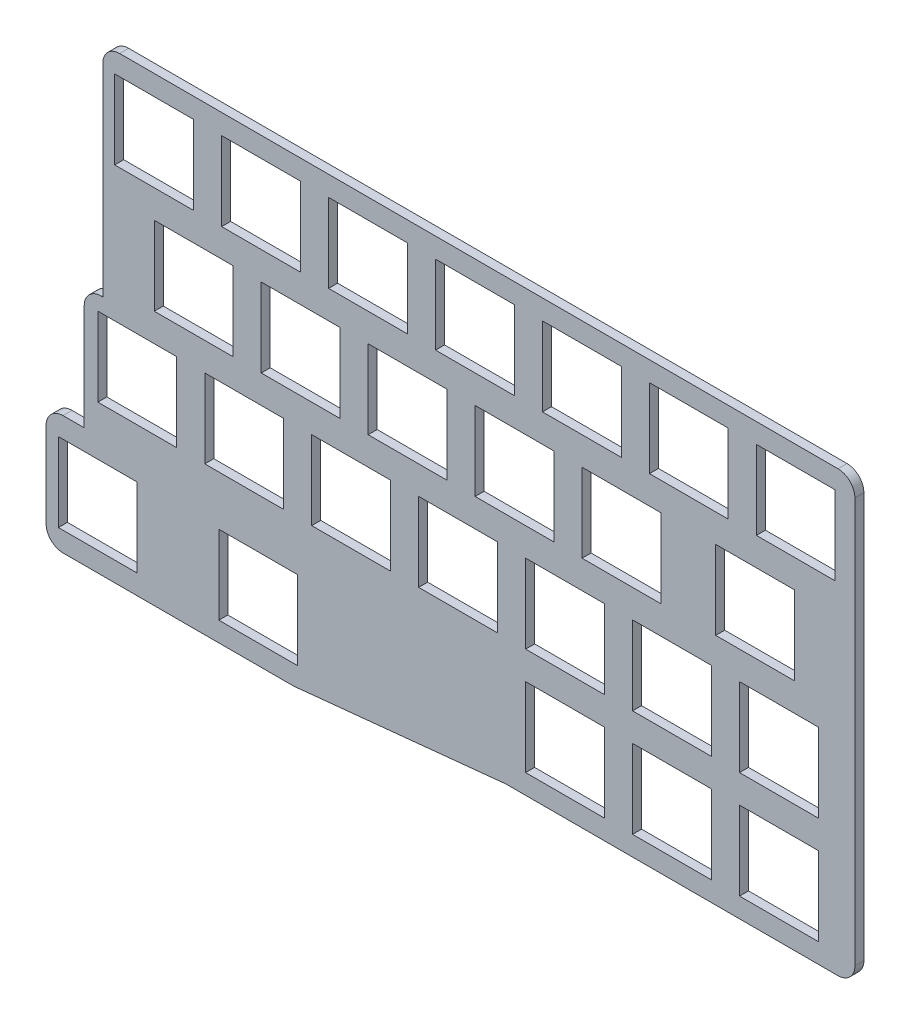
from build123d import *

# Parameters (mm, degrees)
SKETCH1_W           = 14
SKETCH1_H           = 14
BOSS_EXTRUDE1_DEPTH = 1.6
CUT_EXTRUDE1_DEPTH  = 96.918055802
FILLET1_R           = 3


with BuildPart() as part:
    # Sketch1 → Boss-Extrude1 (new body)
    with BuildSketch(Plane.XY):
        with BuildLine():
            Line((-78.750976664, 0.641871894), (-78.750976664, 47.553166294))
            ThreePointArc((-78.750976664, 47.553166294), (-77.871635054, 49.67514838), (-75.749104672, 50.553165702))
            Line((-75.749104672, 50.553165702), (78.500895328, 50.456909802))
            ThreePointArc((78.500895328, 50.456909802), (80.621005422, 49.577568802), (81.499023352, 47.456910433))
            Line((81.499023352, 47.456910433), (81.499023352, -24.544961067))
            ThreePointArc((81.499023352, -24.544961067), (80.620343696, -26.666281411), (78.499023352, -27.544961067))
            Line((78.499023352, -27.544961067), (19.649835152, -27.544961067))
            ThreePointArc((19.649835152, -27.544961067), (19.499213793, -27.548744585), (19.348972354, -27.560085596))
            Line((19.348972354, -27.560085596), (-18.050925646, -31.329836596))
            ThreePointArc((-18.050925646, -31.329836596), (-18.201167086, -31.341177607), (-18.351788445, -31.344961125))
            Line((-18.351788445, -31.344961125), (-66.088698945, -31.344961125))
            ThreePointArc((-66.088698945, -31.344961125), (-67.842829771, -30.778687705), (-68.934748827, -29.2936445))
            Line((-68.934748827, -29.2936445), (-78.597026527, -0.3068115))
            ThreePointArc((-78.597026527, -0.3068115), (-78.712239029, 0.161325115), (-78.750976664, 0.641871894))
        make_face()
        with Locations((67.999023336, -17.044961106)):
            Rectangle(SKETCH1_W, SKETCH1_H, mode=Mode.SUBTRACT)
        with Locations((-46.000976664, 1.955038894)):
            Rectangle(SKETCH1_W, SKETCH1_H, mode=Mode.SUBTRACT)
        with Locations((-43.000976664, 39.955038894)):
            Rectangle(SKETCH1_W, SKETCH1_H, mode=Mode.SUBTRACT)
        with Locations((-24.000976664, 39.955038894)):
            Rectangle(SKETCH1_W, SKETCH1_H, mode=Mode.SUBTRACT)
        with Locations((-5.000976664, 39.955038894)):
            Rectangle(SKETCH1_W, SKETCH1_H, mode=Mode.SUBTRACT)
        with Locations((13.999023336, 39.955038894)):
            Rectangle(SKETCH1_W, SKETCH1_H, mode=Mode.SUBTRACT)
        with Locations((32.999023336, 39.955038894)):
            Rectangle(SKETCH1_W, SKETCH1_H, mode=Mode.SUBTRACT)
        with Locations((51.999023336, 39.955038894)):
            Rectangle(SKETCH1_W, SKETCH1_H, mode=Mode.SUBTRACT)
        with Locations((70.999023336, 39.955038894)):
            Rectangle(SKETCH1_W, SKETCH1_H, mode=Mode.SUBTRACT)
        with Locations((-35.970976664, 20.955038894)):
            Rectangle(SKETCH1_W, SKETCH1_H, mode=Mode.SUBTRACT)
        with Locations((-16.970976664, 20.955038894)):
            Rectangle(SKETCH1_W, SKETCH1_H, mode=Mode.SUBTRACT)
        with Locations((2.029023336, 20.955038894)):
            Rectangle(SKETCH1_W, SKETCH1_H, mode=Mode.SUBTRACT)
        with Locations((21.029023336, 20.955038894)):
            Rectangle(SKETCH1_W, SKETCH1_H, mode=Mode.SUBTRACT)
        with Locations((40.029023336, 20.955038894)):
            Rectangle(SKETCH1_W, SKETCH1_H, mode=Mode.SUBTRACT)
        with Locations((63.779023336, 20.955038894)):
            Rectangle(SKETCH1_W, SKETCH1_H, mode=Mode.SUBTRACT)
        with Locations((-27.000976664, 1.955038894)):
            Rectangle(SKETCH1_W, SKETCH1_H, mode=Mode.SUBTRACT)
        with Locations((-8.000976664, 1.955038894)):
            Rectangle(SKETCH1_W, SKETCH1_H, mode=Mode.SUBTRACT)
        with Locations((10.999023336, 1.955038894)):
            Rectangle(SKETCH1_W, SKETCH1_H, mode=Mode.SUBTRACT)
        with Locations((29.999023336, 1.955038894)):
            Rectangle(SKETCH1_W, SKETCH1_H, mode=Mode.SUBTRACT)
        with Locations((48.999023336, 1.955038894)):
            Rectangle(SKETCH1_W, SKETCH1_H, mode=Mode.SUBTRACT)
        with Locations((67.999023336, 1.955038894)):
            Rectangle(SKETCH1_W, SKETCH1_H, mode=Mode.SUBTRACT)
        with Locations((29.999023336, -17.044961106)):
            Rectangle(SKETCH1_W, SKETCH1_H, mode=Mode.SUBTRACT)
        with Locations((48.999023336, -17.044961106)):
            Rectangle(SKETCH1_W, SKETCH1_H, mode=Mode.SUBTRACT)
        with Locations((-53.000976664, -20.844961106)):
            Rectangle(SKETCH1_W, SKETCH1_H, mode=Mode.SUBTRACT)
        with Locations((-24.500976664, -20.844961106)):
            Rectangle(SKETCH1_W, SKETCH1_H, mode=Mode.SUBTRACT)
    extrude(amount=BOSS_EXTRUDE1_DEPTH)

    # Sketch2 → Cut-Extrude1 (cut, through all)
    with BuildSketch(Plane.XY.offset(1.6)):
        Polygon((-52.113994262, 52.196412896), (-52.113994262, 11.585140269), (-55.415723743, 11.585140269), (-55.415723743, -10.206274311), (-62.184269181, -10.206274311), (-62.184269181, -38.601147855), (-84.470943183, -34.143813054), (-95.201563999, 49.885202259), (-53.764859002, 58.304612437), align=None)
    extrude(amount=-CUT_EXTRUDE1_DEPTH, mode=Mode.SUBTRACT)

    # Fillet1
    fillet1_edges = [part.edges().sort_by_distance(p)[0] for p in [
        (-52.113994262, 50.538416795, 0.8),
        (-62.184269181, -31.344961125, 0.8),
        (-62.184269181, -10.206274311, 0.8),
        (-55.415723743, 11.585140269, 0.8),
    ]]
    fillet(fillet1_edges, radius=FILLET1_R)


solid = part.part
